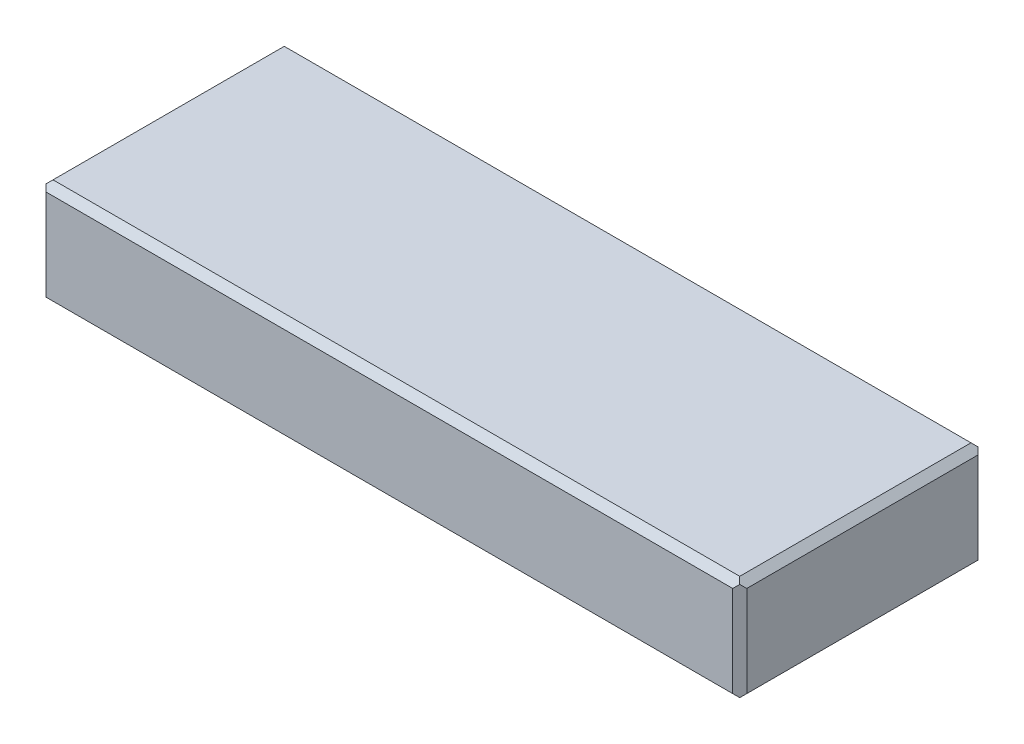
from build123d import *

# Parameters (mm, degrees)
ESQUISSE1_W      = 200
ESQUISSE1_H      = 30
EXTRUSION1_DEPTH = 70
CHANFREIN1_SIZE  = 2
CHANFREIN2_SIZE  = 2
CHANFREIN3_SIZE  = 2


with BuildPart() as part:
    # Esquisse1 → Extrusion1 (new body)
    with BuildSketch(Plane.XY):
        with Locations((50.878134685, 14.151054852)):
            Rectangle(ESQUISSE1_W, ESQUISSE1_H)
    extrude(amount=EXTRUSION1_DEPTH)

    # Chanfrein1
    chanfrein1_edges = [part.edges().sort_by_distance(p)[0] for p in [
        (50.878134685, -0.848945148, 0),
        (50.878134685, -0.848945148, 70),
        (150.878134685, -0.848945148, 35),
        (-49.121865315, -0.848945148, 35),
    ]]
    chamfer(chanfrein1_edges, length=CHANFREIN1_SIZE)

    # Chanfrein2
    chanfrein2_edges = [part.edges().sort_by_distance(p)[0] for p in [
        (50.878134685, 29.151054852, 70),
        (50.878134685, 29.151054852, 0),
        (-49.121865315, 29.151054852, 35),
        (150.878134685, 29.151054852, 35),
    ]]
    chamfer(chanfrein2_edges, length=CHANFREIN2_SIZE)

    # Chanfrein3
    chanfrein3_edges = [part.edges().sort_by_distance(p)[0] for p in [
        (150.878134685, 14.151054852, 0),
        (150.878134685, 14.151054852, 70),
        (-49.121865315, 14.151054852, 0),
        (-49.121865315, 14.151054852, 70),
    ]]
    chamfer(chanfrein3_edges, length=CHANFREIN3_SIZE)


solid = part.part
